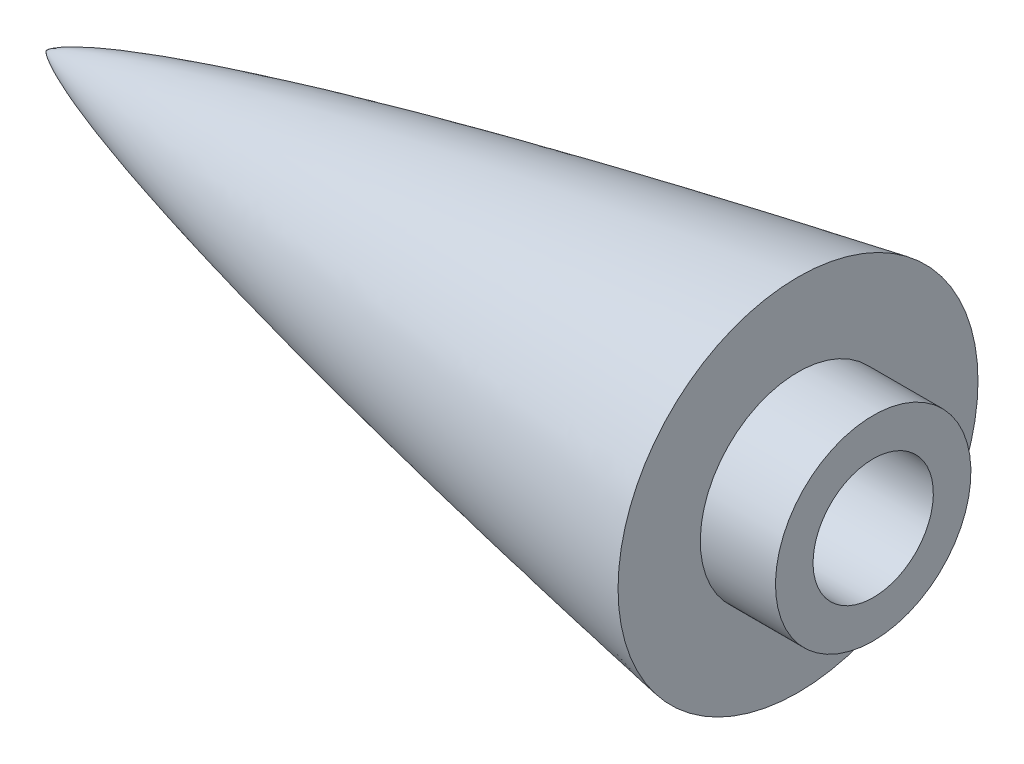
from build123d import *

# Parameters (mm, degrees)
SKETCH2_R          = 5.08
CUT_EXTRUDE1_DEPTH = 16.51


with BuildPart() as part:
    # Sketch1 → Revolve2 (revolve)
    with BuildSketch(Plane.XY, mode=Mode.PRIVATE) as revolve2_sk:
        with BuildLine():
            Line((0.076912079, 0), (19.729098629, 0))
            Line((19.729098629, 0), (69.926912079, 0))
            Line((69.926912079, 0), (69.926912079, 8.255))
            Line((69.926912079, 8.255), (63.576912079, 8.255))
            Line((63.576912079, 8.255), (63.576912079, 10.736964756))
            Line((63.576912079, 10.736964756), (63.576912079, 15.202327863))
            add(Edge.make_bspline(
                [(0.076912079, 0), (0.078969442, 0.006654897), (0.084493501, 0.019331639), (0.099015149, 0.040214938), (0.122193786, 0.068181148), (0.154037071, 0.101030827), (0.200164992, 0.143430217), (0.268241975, 0.199491093), (0.377989498, 0.280420084), (0.559011436, 0.399466477), (0.865430107, 0.578065399), (1.393090445, 0.849562336), (2.310397178, 1.263377843), (3.785778471, 1.84589404), (6.274670901, 2.711974419), (9.686218669, 3.755081994), (13.839662552, 4.9000227), (18.527460046, 6.08758867), (23.239882114, 7.206459906), (27.953067809, 8.268747256), (32.695008152, 9.290547714), (37.413075952, 10.2699645), (42.191578277, 11.227495954), (46.290387037, 12.025933106), (49.945283894, 12.719608632), (52.775241544, 13.249955676), (55.409936962, 13.734142868), (57.893416235, 14.189994092), (60.913953522, 14.730387672), (62.492375844, 15.01102822), (63.576912079, 15.202327863)],
                knots=[0, 0, 0, 0, 0, 0.000385743, 0.000771486, 0.001402618, 0.002022882, 0.002925437, 0.004255336, 0.006303998, 0.009601903, 0.014969439, 0.0239661, 0.039294941, 0.065529067, 0.10316947, 0.170438202, 0.237706928, 0.304975663, 0.372244397, 0.43951313, 0.506781866, 0.574050599, 0.641319334, 0.708588068, 0.742222435, 0.775856802, 0.809491169, 0.843125536, 0.91039427, 0.91039427, 0.91039427, 0.91039427, 0.91039427], degree=4))
        make_face()
    revolve(revolve2_sk.sketch.rotate(Axis((0.076912079, 0, 0), (1, 0, 0)), 180), axis=Axis((0.076912079, 0, 0), (1, 0, 0)))

    # Sketch2 → Cut-Extrude1 (cut)
    with BuildSketch(Plane(origin=(69.926912079, 0, 0), x_dir=(0, 0, -1), z_dir=(1, 0, 0))):
        with Locations(Location((0, 0, 0), (0, 0, 90))):
            Circle(SKETCH2_R)
    extrude(amount=-CUT_EXTRUDE1_DEPTH, mode=Mode.SUBTRACT)


solid = part.part
